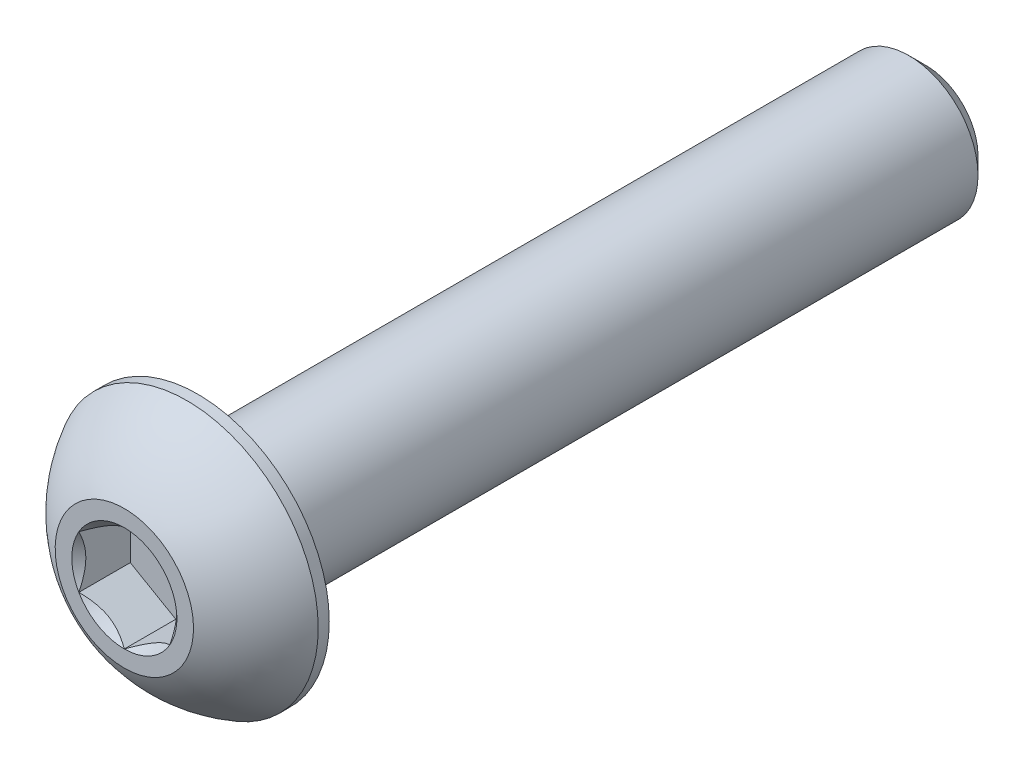
from build123d import *

# Parameters (mm, degrees)
SKETCH1_W          = 25.4
SKETCH1_H          = 2.413
CHAMFER1_SIZE      = 0.5953125
CUT_EXTRUDE2_DEPTH = 1.79578
SKETCH6_R          = 1.833087105
CUT_EXTRUDE3_DEPTH = 1.79578
CUT_EXTRUDE3_TAPER = 45


with BuildPart() as part:
    # Sketch1 → Revolve1 (revolve)
    with BuildSketch(Plane(origin=(0, 0, 0), x_dir=(0, 0, -1), z_dir=(1, 0, 0))):
        with Locations((15.2654, 1.2065)):
            Rectangle(SKETCH1_W, SKETCH1_H)
    revolve(axis=Axis((0, 0, -27.9654), (0, 0, 1)))

    # Chamfer1
    chamfer1_edges = [part.edges().sort_by_distance(p)[0] for p in [
        (0, -2.413, -27.9654),
    ]]
    chamfer(chamfer1_edges, length=CHAMFER1_SIZE)

    # Sketch7 → Revolve2 (revolve)
    with BuildSketch(Plane(origin=(0, 0, 0), x_dir=(0, 0, -1), z_dir=(1, 0, 0)), mode=Mode.PRIVATE) as revolve2_sk:
        with BuildLine():
            Line((2.18059, 4.5847), (2.5654, 4.5847))
            Line((2.5654, 4.5847), (2.5654, 0))
            Line((2.5654, 0), (0, 0))
            Line((0, 0), (0, 2.413))
            ThreePointArc((0, 2.413), (0.925030326, 3.664791196), (2.18059, 4.5847))
        make_face()
    revolve(revolve2_sk.sketch.rotate(Axis((0, 0, 0), (0, 0, -1)), 180), axis=Axis((0, 0, 0), (0, 0, -1)))

    # Sketch5 → Cut-Extrude2 (cut)
    with BuildSketch(Plane.XY):
        Polygon((1.5875, -0.916543552), (1.5875, 0.916543552), (0, 1.833087105), (-1.5875, 0.916543552), (-1.5875, -0.916543552), (0, -1.833087105), align=None)
    extrude(amount=-CUT_EXTRUDE2_DEPTH, mode=Mode.SUBTRACT)

    # Sketch6 → Cut-Extrude3 (cut)
    with BuildSketch(Plane.XY):
        Circle(SKETCH6_R)
    extrude(amount=-CUT_EXTRUDE3_DEPTH, taper=CUT_EXTRUDE3_TAPER, mode=Mode.SUBTRACT)


solid = part.part
